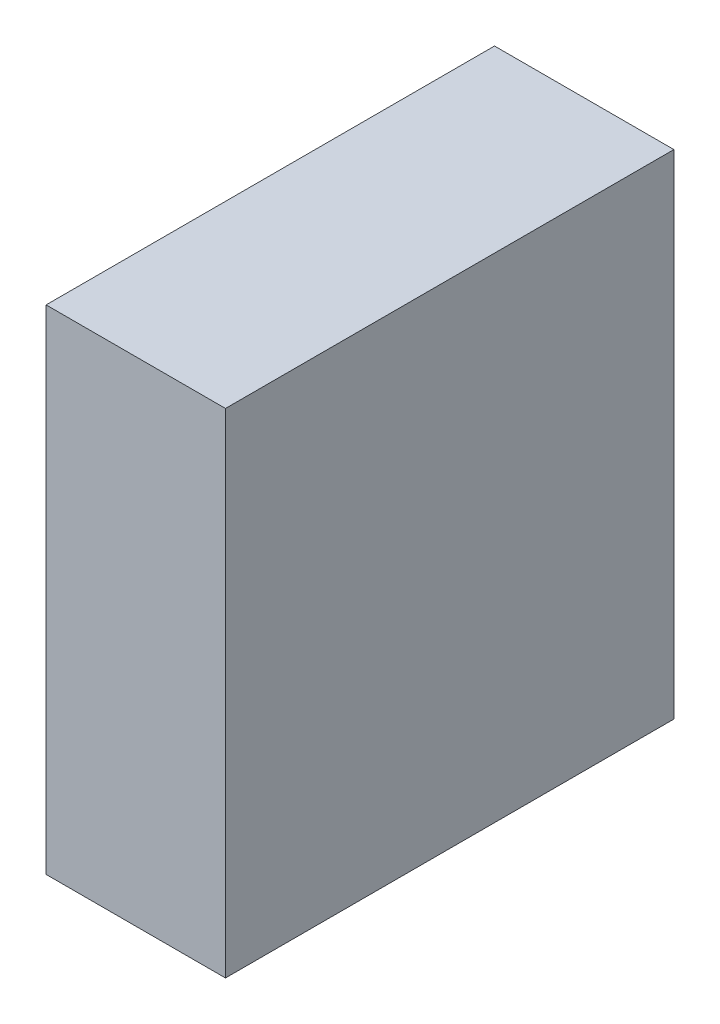
from build123d import *

# Parameters (mm, degrees)
SKETCH_1_W         = 2
SKETCH_1_H         = 5.5
COMPACT_YOKE_DEPTH = 5


with BuildPart() as part:
    # 草图1 → Compact_yoke (new body)
    with BuildSketch(Plane.XY):
        with Locations((1, 2.75)):
            Rectangle(SKETCH_1_W, SKETCH_1_H)
    extrude(amount=COMPACT_YOKE_DEPTH)


solid = part.part
